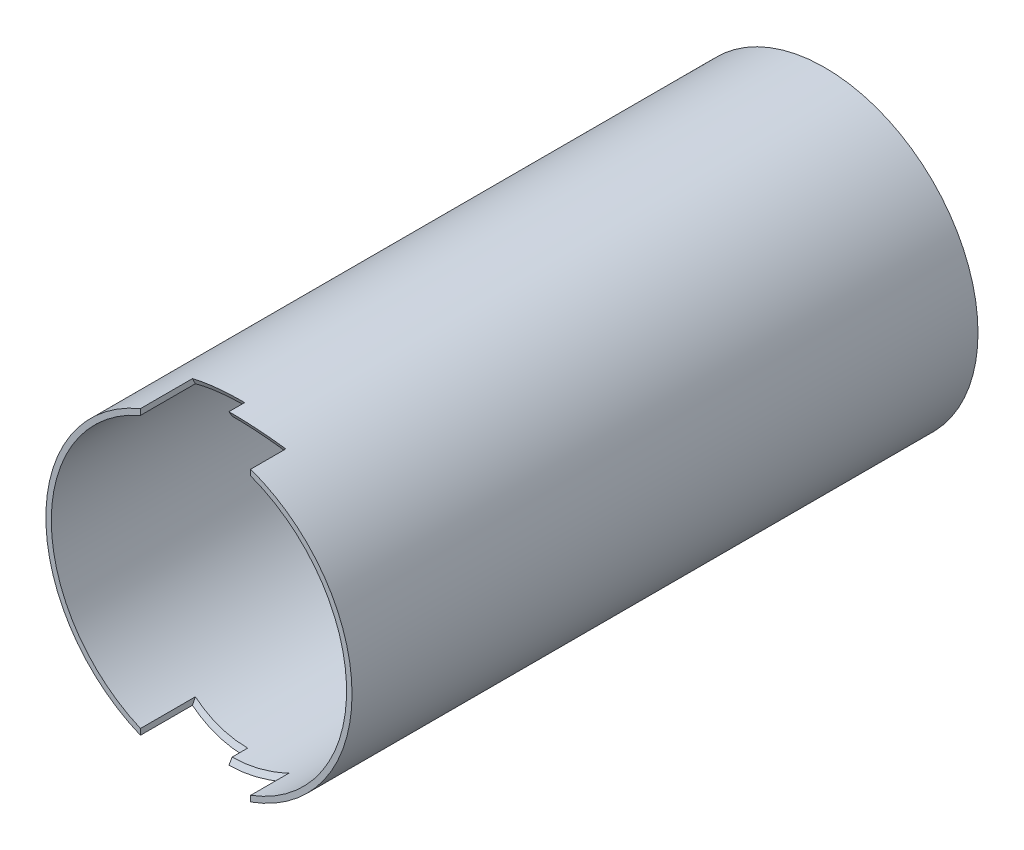
from build123d import *

# Parameters (mm, degrees)
SKETCH1_R           = 22.499999958
SKETCH1_R_2         = 21.699999958
BOSS_EXTRUDE1_DEPTH = 92
SKETCH3_R           = 45.65
CUT_EXTRUDE1_DEPTH  = 8.6
SKETCH3_3_R         = 43.65
CUT_EXTRUDE2_DEPTH  = 7.6


with BuildPart() as part:
    # Sketch1 → Boss-Extrude1 (new body)
    with BuildSketch(Plane(origin=(0, 0, 0), x_dir=(0, 1, 0), z_dir=(0, 0, 1))):
        with Locations(Location((0, 0, 0), (0, 0, 270))):
            Circle(SKETCH1_R)
        with Locations(Location((0, 0, 0), (0, 0, 270))):
            Circle(SKETCH1_R_2, mode=Mode.SUBTRACT)
    extrude(amount=BOSS_EXTRUDE1_DEPTH)

    # Sketch3 → Cut-Extrude1 (cut)
    with BuildSketch(Plane.YZ):
        with Locations((0, 125)):
            Circle(SKETCH3_R)
    extrude(amount=-CUT_EXTRUDE1_DEPTH, mode=Mode.SUBTRACT)

    # Sketch3<3> → Cut-Extrude2 (cut)
    with BuildSketch(Plane.YZ):
        with Locations((0, 125)):
            Circle(SKETCH3_3_R)
    extrude(amount=CUT_EXTRUDE2_DEPTH, mode=Mode.SUBTRACT)


solid = part.part
